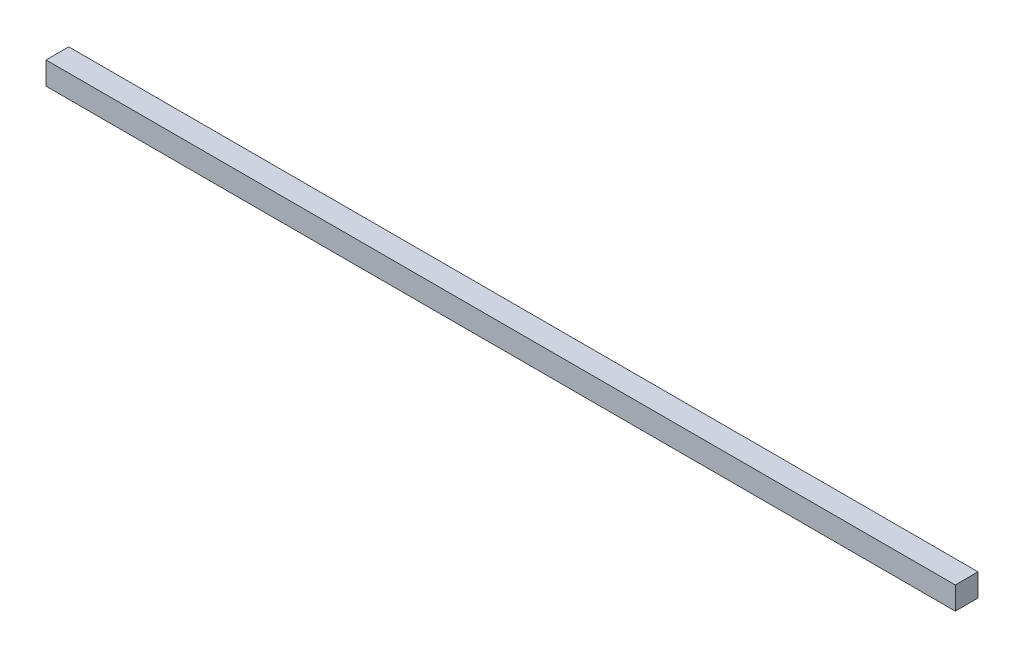
from build123d import *

# Parameters (mm, degrees)
SKETCH1_W           = 400
SKETCH1_H           = 10
BOSS_EXTRUDE1_DEPTH = 10


with BuildPart() as part:
    # Sketch1 → Boss-Extrude1 (new body)
    with BuildSketch(Plane(origin=(0, 0, 0), x_dir=(1, 0, 0), z_dir=(0, 1, 0))):
        with Locations((200, -5)):
            Rectangle(SKETCH1_W, SKETCH1_H)
    extrude(amount=BOSS_EXTRUDE1_DEPTH)


solid = part.part
